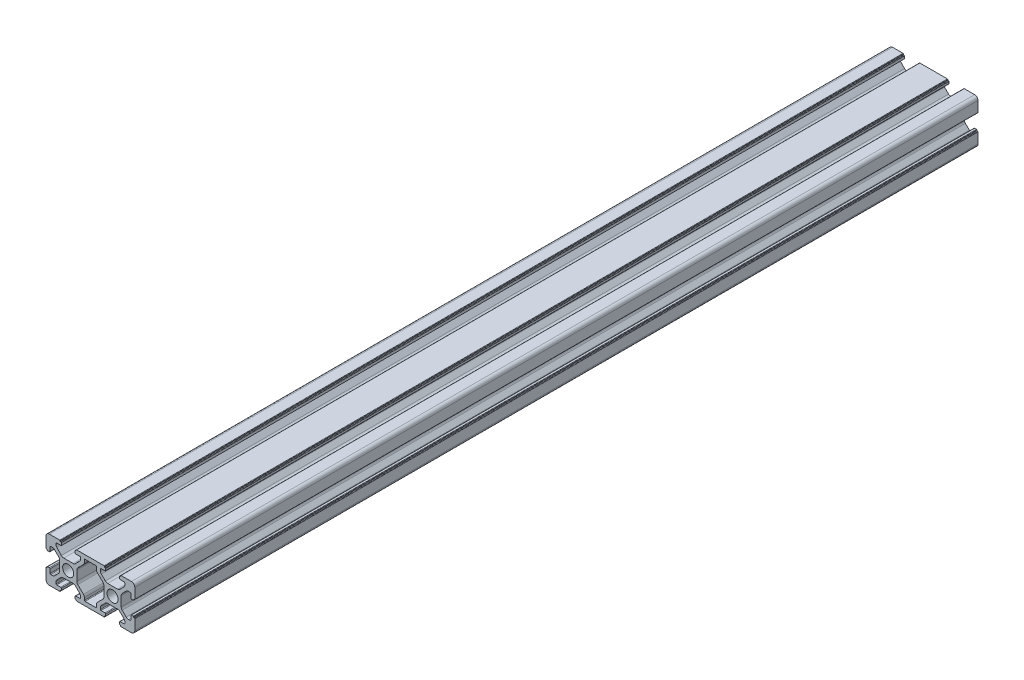
from build123d import *

# Parameters (mm, degrees)
SKETCH1_R           = 2.5
BOSS_EXTRUDE2_DEPTH = 380


with BuildPart() as part:
    # Sketch1 → Boss-Extrude2 (new body)
    with BuildSketch(Plane.XY):
        with BuildLine():
            Line((1.5, 0), (6.2, 0))
            ThreePointArc((6.2, 0), (6.341421356, 0.058578644), (6.4, 0.2))
            Line((6.4, 0.2), (6.4, 0.3))
            ThreePointArc((6.4, 0.3), (6.458578644, 0.441421356), (6.6, 0.5))
            Line((6.6, 0.5), (6.7, 0.5))
            ThreePointArc((6.7, 0.5), (6.841421356, 0.558578644), (6.9, 0.7))
            Line((6.9, 0.7), (6.9, 1.5))
            ThreePointArc((6.9, 1.5), (6.812132034, 1.712132034), (6.6, 1.8))
            Line((6.6, 1.8), (4.8, 1.8))
            ThreePointArc((4.8, 1.8), (4.587867966, 1.887867966), (4.5, 2.1))
            Line((4.5, 2.1), (4.5, 2.818019485))
            ThreePointArc((4.5, 2.818019485), (4.614180701, 3.392044633), (4.939339828, 3.878679656))
            Line((4.939339828, 3.878679656), (6.721320344, 5.660660172))
            ThreePointArc((6.721320344, 5.660660172), (7.207955367, 5.985819299), (7.781980515, 6.1))
            Line((7.781980515, 6.1), (12.218019485, 6.1))
            ThreePointArc((12.218019485, 6.1), (12.792044633, 5.985819299), (13.278679656, 5.660660172))
            Line((13.278679656, 5.660660172), (15.060660172, 3.878679656))
            ThreePointArc((15.060660172, 3.878679656), (15.385819299, 3.392044633), (15.5, 2.818019485))
            Line((15.5, 2.818019485), (15.5, 2.1))
            ThreePointArc((15.5, 2.1), (15.412132034, 1.887867966), (15.2, 1.8))
            Line((15.2, 1.8), (13.4, 1.8))
            ThreePointArc((13.4, 1.8), (13.187867966, 1.712132034), (13.1, 1.5))
            Line((13.1, 1.5), (13.1, 0.7))
            ThreePointArc((13.1, 0.7), (13.158578644, 0.558578644), (13.3, 0.5))
            Line((13.3, 0.5), (13.4, 0.5))
            ThreePointArc((13.4, 0.5), (13.541421356, 0.441421356), (13.6, 0.3))
            Line((13.6, 0.3), (13.6, 0.2))
            ThreePointArc((13.6, 0.2), (13.658578644, 0.058578644), (13.8, 0))
            Line((13.8, 0), (26.2, 0))
            ThreePointArc((26.2, 0), (26.341421356, 0.058578644), (26.4, 0.2))
            Line((26.4, 0.2), (26.4, 0.3))
            ThreePointArc((26.4, 0.3), (26.458578644, 0.441421356), (26.6, 0.5))
            Line((26.6, 0.5), (26.7, 0.5))
            ThreePointArc((26.7, 0.5), (26.841421356, 0.558578644), (26.9, 0.7))
            Line((26.9, 0.7), (26.9, 1.5))
            ThreePointArc((26.9, 1.5), (26.812132034, 1.712132034), (26.6, 1.8))
            Line((26.6, 1.8), (24.8, 1.8))
            ThreePointArc((24.8, 1.8), (24.587867966, 1.887867966), (24.5, 2.1))
            Line((24.5, 2.1), (24.5, 2.818019485))
            ThreePointArc((24.5, 2.818019485), (24.614180701, 3.392044633), (24.939339828, 3.878679656))
            Line((24.939339828, 3.878679656), (26.721320344, 5.660660172))
            ThreePointArc((26.721320344, 5.660660172), (27.207955367, 5.985819299), (27.781980515, 6.1))
            Line((27.781980515, 6.1), (32.218019485, 6.1))
            ThreePointArc((32.218019485, 6.1), (32.792044633, 5.985819299), (33.278679656, 5.660660172))
            Line((33.278679656, 5.660660172), (35.060660172, 3.878679656))
            ThreePointArc((35.060660172, 3.878679656), (35.385819299, 3.392044633), (35.5, 2.818019485))
            Line((35.5, 2.818019485), (35.5, 2.1))
            ThreePointArc((35.5, 2.1), (35.412132034, 1.887867966), (35.2, 1.8))
            Line((35.2, 1.8), (33.4, 1.8))
            ThreePointArc((33.4, 1.8), (33.187867966, 1.712132034), (33.1, 1.5))
            Line((33.1, 1.5), (33.1, 0.7))
            ThreePointArc((33.1, 0.7), (33.158578644, 0.558578644), (33.3, 0.5))
            Line((33.3, 0.5), (33.4, 0.5))
            ThreePointArc((33.4, 0.5), (33.541421356, 0.441421356), (33.6, 0.3))
            Line((33.6, 0.3), (33.6, 0.2))
            ThreePointArc((33.6, 0.2), (33.658578644, 0.058578644), (33.8, 0))
            Line((33.8, 0), (38.5, 0))
            ThreePointArc((38.5, 0), (39.560660172, 0.439339828), (40, 1.5))
            Line((40, 1.5), (40, 6.2))
            ThreePointArc((40, 6.2), (39.941421356, 6.341421356), (39.8, 6.4))
            Line((39.8, 6.4), (39.7, 6.4))
            ThreePointArc((39.7, 6.4), (39.558578644, 6.458578644), (39.5, 6.6))
            Line((39.5, 6.6), (39.5, 6.7))
            ThreePointArc((39.5, 6.7), (39.441421356, 6.841421356), (39.3, 6.9))
            Line((39.3, 6.9), (38.5, 6.9))
            ThreePointArc((38.5, 6.9), (38.287867966, 6.812132034), (38.2, 6.6))
            Line((38.2, 6.6), (38.2, 4.8))
            ThreePointArc((38.2, 4.8), (38.112132034, 4.587867966), (37.9, 4.5))
            Line((37.9, 4.5), (37.181980515, 4.5))
            ThreePointArc((37.181980515, 4.5), (36.607955367, 4.614180701), (36.121320344, 4.939339828))
            Line((36.121320344, 4.939339828), (34.339339828, 6.721320344))
            ThreePointArc((34.339339828, 6.721320344), (34.014180701, 7.207955367), (33.9, 7.781980515))
            Line((33.9, 7.781980515), (33.9, 12.218019485))
            ThreePointArc((33.9, 12.218019485), (34.014180701, 12.792044633), (34.339339828, 13.278679656))
            Line((34.339339828, 13.278679656), (36.121320344, 15.060660172))
            ThreePointArc((36.121320344, 15.060660172), (36.607955367, 15.385819299), (37.181980515, 15.5))
            Line((37.181980515, 15.5), (37.9, 15.5))
            ThreePointArc((37.9, 15.5), (38.112132034, 15.412132034), (38.2, 15.2))
            Line((38.2, 15.2), (38.2, 13.4))
            ThreePointArc((38.2, 13.4), (38.287867966, 13.187867966), (38.5, 13.1))
            Line((38.5, 13.1), (39.3, 13.1))
            ThreePointArc((39.3, 13.1), (39.441421356, 13.158578644), (39.5, 13.3))
            Line((39.5, 13.3), (39.5, 13.4))
            ThreePointArc((39.5, 13.4), (39.558578644, 13.541421356), (39.7, 13.6))
            Line((39.7, 13.6), (39.8, 13.6))
            ThreePointArc((39.8, 13.6), (39.941421356, 13.658578644), (40, 13.8))
            Line((40, 13.8), (40, 18.5))
            ThreePointArc((40, 18.5), (39.560660172, 19.560660172), (38.5, 20))
            Line((38.5, 20), (33.8, 20))
            ThreePointArc((33.8, 20), (33.658578644, 19.941421356), (33.6, 19.8))
            Line((33.6, 19.8), (33.6, 19.7))
            ThreePointArc((33.6, 19.7), (33.541421356, 19.558578644), (33.4, 19.5))
            Line((33.4, 19.5), (33.3, 19.5))
            ThreePointArc((33.3, 19.5), (33.158578644, 19.441421356), (33.1, 19.3))
            Line((33.1, 19.3), (33.1, 18.5))
            ThreePointArc((33.1, 18.5), (33.187867966, 18.287867966), (33.4, 18.2))
            Line((33.4, 18.2), (35.2, 18.2))
            ThreePointArc((35.2, 18.2), (35.412132034, 18.112132034), (35.5, 17.9))
            Line((35.5, 17.9), (35.5, 17.181980515))
            ThreePointArc((35.5, 17.181980515), (35.385819299, 16.607955367), (35.060660172, 16.121320344))
            Line((35.060660172, 16.121320344), (33.278679656, 14.339339828))
            ThreePointArc((33.278679656, 14.339339828), (32.792044633, 14.014180701), (32.218019485, 13.9))
            Line((32.218019485, 13.9), (27.781980515, 13.9))
            ThreePointArc((27.781980515, 13.9), (27.207955367, 14.014180701), (26.721320344, 14.339339828))
            Line((26.721320344, 14.339339828), (24.939339828, 16.121320344))
            ThreePointArc((24.939339828, 16.121320344), (24.614180701, 16.607955367), (24.5, 17.181980515))
            Line((24.5, 17.181980515), (24.5, 17.9))
            ThreePointArc((24.5, 17.9), (24.587867966, 18.112132034), (24.8, 18.2))
            Line((24.8, 18.2), (26.6, 18.2))
            ThreePointArc((26.6, 18.2), (26.812132034, 18.287867966), (26.9, 18.5))
            Line((26.9, 18.5), (26.9, 19.3))
            ThreePointArc((26.9, 19.3), (26.841421356, 19.441421356), (26.7, 19.5))
            Line((26.7, 19.5), (26.6, 19.5))
            ThreePointArc((26.6, 19.5), (26.458578644, 19.558578644), (26.4, 19.7))
            Line((26.4, 19.7), (26.4, 19.8))
            ThreePointArc((26.4, 19.8), (26.341421356, 19.941421356), (26.2, 20))
            Line((26.2, 20), (13.8, 20))
            ThreePointArc((13.8, 20), (13.658578644, 19.941421356), (13.6, 19.8))
            Line((13.6, 19.8), (13.6, 19.7))
            ThreePointArc((13.6, 19.7), (13.541421356, 19.558578644), (13.4, 19.5))
            Line((13.4, 19.5), (13.3, 19.5))
            ThreePointArc((13.3, 19.5), (13.158578644, 19.441421356), (13.1, 19.3))
            Line((13.1, 19.3), (13.1, 18.2))
            Line((13.1, 18.2), (15.3, 18.2))
            ThreePointArc((15.3, 18.2), (15.512132034, 18.112132034), (15.6, 17.9))
            Line((15.6, 17.9), (15.6, 17.281980515))
            ThreePointArc((15.6, 17.281980515), (15.485819299, 16.707955367), (15.160660172, 16.221320344))
            Line((15.160660172, 16.221320344), (13.278679656, 14.339339828))
            ThreePointArc((13.278679656, 14.339339828), (12.792044633, 14.014180701), (12.218019485, 13.9))
            Line((12.218019485, 13.9), (7.986375635, 13.9))
            ThreePointArc((7.986375635, 13.9), (7.393381044, 14.022191082), (6.896997987, 14.36885678))
            Line((6.896997987, 14.36885678), (4.910622352, 16.467414163))
            ThreePointArc((4.910622352, 16.467414163), (4.606431474, 16.943609851), (4.5, 17.498557383))
            Line((4.5, 17.498557383), (4.5, 17.9))
            ThreePointArc((4.5, 17.9), (4.587867966, 18.112132034), (4.8, 18.2))
            Line((4.8, 18.2), (6.9, 18.2))
            Line((6.9, 18.2), (6.9, 19.3))
            ThreePointArc((6.9, 19.3), (6.841421356, 19.441421356), (6.7, 19.5))
            Line((6.7, 19.5), (6.6, 19.5))
            ThreePointArc((6.6, 19.5), (6.458578644, 19.558578644), (6.4, 19.7))
            Line((6.4, 19.7), (6.4, 19.8))
            ThreePointArc((6.4, 19.8), (6.341421356, 19.941421356), (6.2, 20))
            Line((6.2, 20), (1.5, 20))
            ThreePointArc((1.5, 20), (0.439339828, 19.560660172), (0, 18.5))
            Line((0, 18.5), (0, 13.8))
            ThreePointArc((0, 13.8), (0.058578644, 13.658578644), (0.2, 13.6))
            Line((0.2, 13.6), (0.3, 13.6))
            ThreePointArc((0.3, 13.6), (0.441421356, 13.541421356), (0.5, 13.4))
            Line((0.5, 13.4), (0.5, 13.3))
            ThreePointArc((0.5, 13.3), (0.558578644, 13.158578644), (0.7, 13.1))
            Line((0.7, 13.1), (1.5, 13.1))
            ThreePointArc((1.5, 13.1), (1.712132034, 13.187867966), (1.8, 13.4))
            Line((1.8, 13.4), (1.8, 15.2))
            ThreePointArc((1.8, 15.2), (1.887867966, 15.412132034), (2.1, 15.5))
            Line((2.1, 15.5), (2.818019485, 15.5))
            ThreePointArc((2.818019485, 15.5), (3.392044633, 15.385819299), (3.878679656, 15.060660172))
            Line((3.878679656, 15.060660172), (5.660660172, 13.278679656))
            ThreePointArc((5.660660172, 13.278679656), (5.985819299, 12.792044633), (6.1, 12.218019485))
            Line((6.1, 12.218019485), (6.1, 7.781980515))
            ThreePointArc((6.1, 7.781980515), (5.985819299, 7.207955367), (5.660660172, 6.721320344))
            Line((5.660660172, 6.721320344), (3.878679656, 4.939339828))
            ThreePointArc((3.878679656, 4.939339828), (3.392044633, 4.614180701), (2.818019485, 4.5))
            Line((2.818019485, 4.5), (2.1, 4.5))
            ThreePointArc((2.1, 4.5), (1.887867966, 4.587867966), (1.8, 4.8))
            Line((1.8, 4.8), (1.8, 6.6))
            ThreePointArc((1.8, 6.6), (1.712132034, 6.812132034), (1.5, 6.9))
            Line((1.5, 6.9), (0.7, 6.9))
            ThreePointArc((0.7, 6.9), (0.558578644, 6.841421356), (0.5, 6.7))
            Line((0.5, 6.7), (0.5, 6.6))
            ThreePointArc((0.5, 6.6), (0.441421356, 6.458578644), (0.3, 6.4))
            Line((0.3, 6.4), (0.2, 6.4))
            ThreePointArc((0.2, 6.4), (0.058578644, 6.341421356), (0, 6.2))
            Line((0, 6.2), (0, 1.5))
            ThreePointArc((0, 1.5), (0.439339828, 0.439339828), (1.5, 0))
        make_face()
        with Locations((10, 10)):
            Circle(SKETCH1_R, mode=Mode.SUBTRACT)
        with Locations((30, 10)):
            Circle(SKETCH1_R, mode=Mode.SUBTRACT)
        with BuildLine():
            Line((17.6, 1.8), (22.4, 1.8))
            ThreePointArc((22.4, 1.8), (22.612132034, 1.887867966), (22.7, 2.1))
            Line((22.7, 2.1), (22.7, 3.139339828))
            ThreePointArc((22.7, 3.139339828), (22.814180701, 3.713364977), (23.139339828, 4.2))
            Line((23.139339828, 4.2), (25.660660172, 6.721320344))
            ThreePointArc((25.660660172, 6.721320344), (25.985819299, 7.207955367), (26.1, 7.781980515))
            Line((26.1, 7.781980515), (26.1, 12.218019485))
            ThreePointArc((26.1, 12.218019485), (25.985819299, 12.792044633), (25.660660172, 13.278679656))
            Line((25.660660172, 13.278679656), (23.139339828, 15.8))
            ThreePointArc((23.139339828, 15.8), (22.814180701, 16.286635023), (22.7, 16.860660172))
            Line((22.7, 16.860660172), (22.7, 17.9))
            ThreePointArc((22.7, 17.9), (22.612132034, 18.112132034), (22.4, 18.2))
            Line((22.4, 18.2), (17.6, 18.2))
            ThreePointArc((17.6, 18.2), (17.387867966, 18.112132034), (17.3, 17.9))
            Line((17.3, 17.9), (17.3, 16.860660172))
            ThreePointArc((17.3, 16.860660172), (17.185819299, 16.286635023), (16.860660172, 15.8))
            Line((16.860660172, 15.8), (14.339339828, 13.278679656))
            ThreePointArc((14.339339828, 13.278679656), (14.014180701, 12.792044633), (13.9, 12.218019485))
            Line((13.9, 12.218019485), (13.9, 7.781980515))
            ThreePointArc((13.9, 7.781980515), (14.014180701, 7.207955367), (14.339339828, 6.721320344))
            Line((14.339339828, 6.721320344), (16.860660172, 4.2))
            ThreePointArc((16.860660172, 4.2), (17.185819299, 3.713364977), (17.3, 3.139339828))
            Line((17.3, 3.139339828), (17.3, 2.1))
            ThreePointArc((17.3, 2.1), (17.387867966, 1.887867966), (17.6, 1.8))
        make_face(mode=Mode.SUBTRACT)
    extrude(amount=BOSS_EXTRUDE2_DEPTH)


solid = part.part
